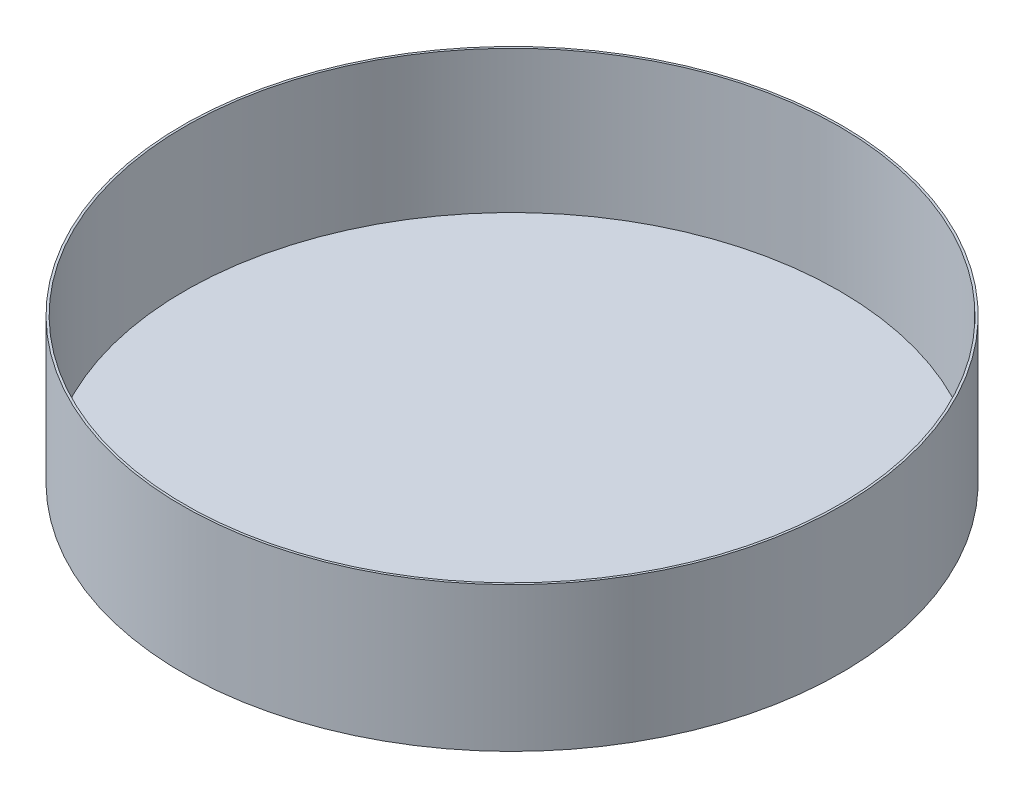
from build123d import *


with BuildPart() as part:
    # Sketch1 → Revolve1 (revolve)
    with BuildSketch(Plane.XY, mode=Mode.PRIVATE) as revolve1_sk:
        Polygon((0, 0), (1495.54, 0), (1495.54, 650), (1505.54, 650), (1505.54, -10), (0, -10), align=None)
    revolve(revolve1_sk.sketch.rotate(Axis((0, 0, 0), (0, 1, 0)), 90), axis=Axis((0, 0, 0), (0, 1, 0)))


solid = part.part
